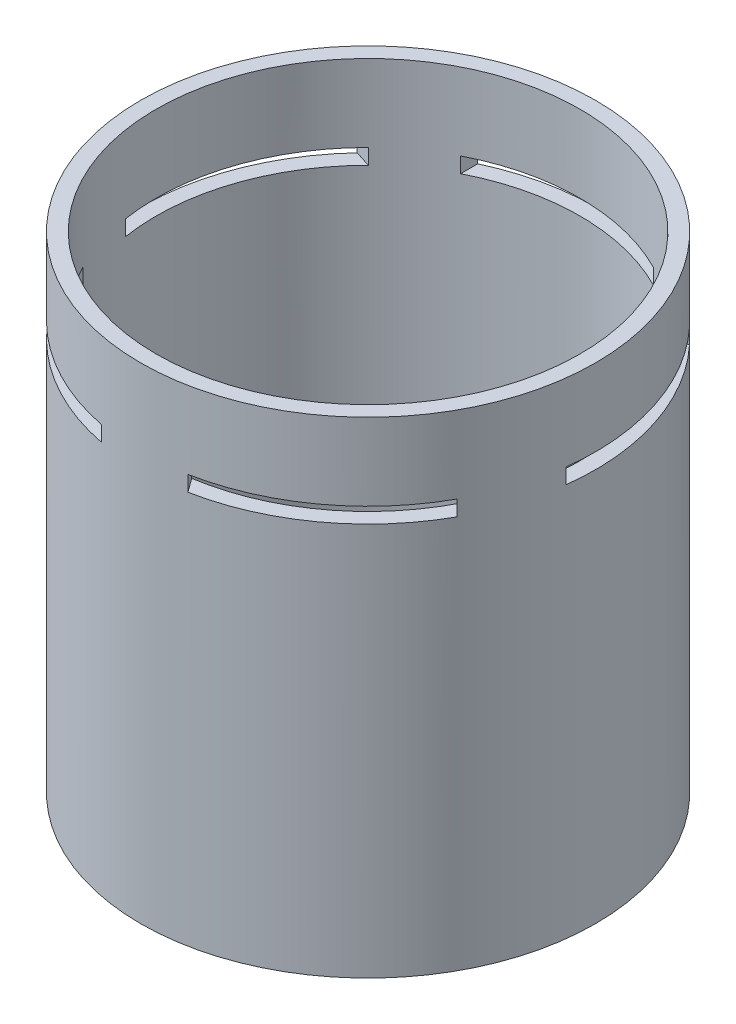
from build123d import *

# Parameters (mm, degrees)
SKETCH1_R           = 29.5
SKETCH1_R_2         = 27.5
BOSS_EXTRUDE1_DEPTH = 63
CUT_EXTRUDE1_DEPTH  = 33
CIRPATTERN1_COUNT   = 5


with BuildPart() as part:
    # Sketch1 → Boss-Extrude1 (new body)
    with BuildSketch(Plane(origin=(0, 0, 0), x_dir=(1, 0, 0), z_dir=(0, 1, 0))):
        with Locations(Location((0, 0, 0), (0, 0, 270))):
            Circle(SKETCH1_R)
        with Locations(Location((0, 0, 0), (0, 0, 270))):
            Circle(SKETCH1_R_2, mode=Mode.SUBTRACT)
    extrude(amount=BOSS_EXTRUDE1_DEPTH)

    # Sketch3 → Cut-Extrude1 (cut)
    with BuildSketch(Plane.XY):
        Polygon((0, 53), (12.5, 53), (12.5, 51), (-12.5, 51), (-12.5, 53), align=None)
    cut_extrude1 = extrude(amount=-CUT_EXTRUDE1_DEPTH, mode=Mode.SUBTRACT)

    # CirPattern1: Cut-Extrude1 ×5 about axis
    cirpattern1_axis = Axis((0, 0, 0), (0, 1, 0))
    for i in range(1, CIRPATTERN1_COUNT):
        add(cut_extrude1.rotate(cirpattern1_axis, i * 360 / CIRPATTERN1_COUNT), mode=Mode.SUBTRACT)


solid = part.part
